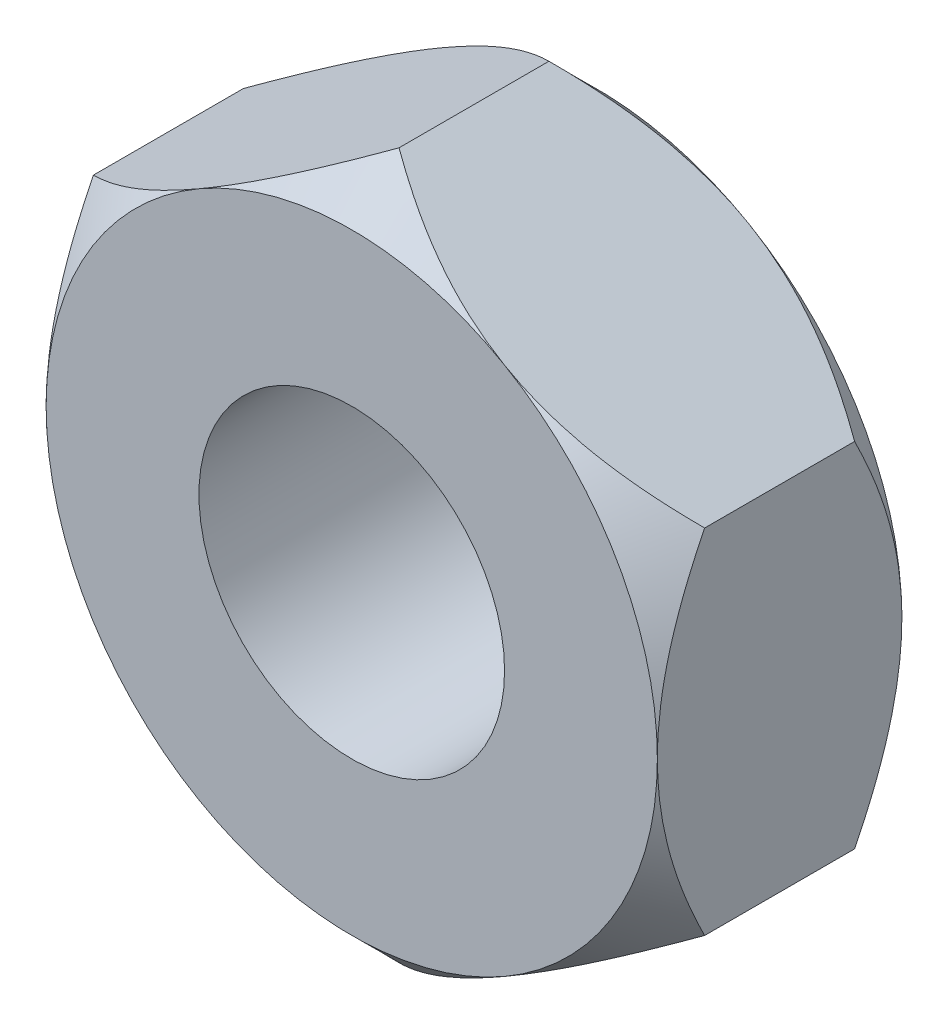
from build123d import *

# Parameters (mm, degrees)
ESBO_O1_R             = 1.25
EXTRUDE_H_DEPTH       = 2
ESBO_O2_OUTSIDE_W     = 12.58
ESBO_O2_OUTSIDE_H     = 13.354
ESBO_O2_OUTSIDE_R     = 2.5
CORTE_EXTRUS_O1_DEPTH = 2
CORTE_EXTRUS_O1_DRAFT = -45
ESBO_O3_OUTSIDE_W     = 12.58
ESBO_O3_OUTSIDE_H     = 13.354
ESBO_O3_OUTSIDE_R     = 2.5
CORTE_EXTRUS_O2_DEPTH = 2
CORTE_EXTRUS_O2_DRAFT = -45


with BuildPart() as part:
    # Esboço1 → H (new body)
    with BuildSketch(Plane.XY):
        Polygon((-2.5, 1.443375673), (-2.5, -1.443375673), (0, -2.886751346), (2.5, -1.443375673), (2.5, 1.443375673), (0, 2.886751346), align=None)
        Circle(ESBO_O1_R, mode=Mode.SUBTRACT)
    extrude(amount=EXTRUDE_H_DEPTH)


with BuildPart() as corte_extrus_o1_tool:
    # Esboço2 outside → Corte-extrusão1 (with draft: the straight prism first)
    with BuildSketch(Plane.XY.offset(2)):
        Rectangle(ESBO_O2_OUTSIDE_W, ESBO_O2_OUTSIDE_H)
        Circle(ESBO_O2_OUTSIDE_R, mode=Mode.SUBTRACT)
    extrude(amount=-CORTE_EXTRUS_O1_DEPTH)
    # Corte-extrusão1: the draft: its side faces are tilted about the plane it starts from
    corte_extrus_o1_sides = [corte_extrus_o1_tool.faces().sort_by_distance(p)[0] for p in [
        (0, -6.677, 1),
        (6.29, 0, 1),
        (0, 6.677, 1),
        (-6.29, 0, 1),
        (-2.5, 0, 1),
    ]]
    draft(corte_extrus_o1_sides, Plane.XY.offset(2), CORTE_EXTRUS_O1_DRAFT)


with BuildPart() as part_1:
    add(part.part)

    # Corte-extrusão1: cut by corte_extrus_o1_tool
    add(corte_extrus_o1_tool.part, mode=Mode.SUBTRACT)


with BuildPart() as corte_extrus_o2_tool:
    # Esboço3 outside → Corte-extrusão2 (with draft: the straight prism first)
    with BuildSketch(Plane(origin=(0, 0, 0), x_dir=(-1, 0, 0), z_dir=(0, 0, -1))):
        Rectangle(ESBO_O3_OUTSIDE_W, ESBO_O3_OUTSIDE_H)
        Circle(ESBO_O3_OUTSIDE_R, mode=Mode.SUBTRACT)
    extrude(amount=-CORTE_EXTRUS_O2_DEPTH)
    # Corte-extrusão2: the draft: its side faces are tilted about the plane it starts from
    corte_extrus_o2_sides = [corte_extrus_o2_tool.faces().sort_by_distance(p)[0] for p in [
        (0, -6.677, 1),
        (-6.29, 0, 1),
        (0, 6.677, 1),
        (6.29, 0, 1),
        (2.5, 0, 1),
    ]]
    draft(corte_extrus_o2_sides, Plane(origin=(0, 0, 0), x_dir=(-1, 0, 0), z_dir=(0, 0, -1)), CORTE_EXTRUS_O2_DRAFT)


with BuildPart() as part_2:
    add(part_1.part)

    # Corte-extrusão2: cut by corte_extrus_o2_tool
    add(corte_extrus_o2_tool.part, mode=Mode.SUBTRACT)


solid = part_2.part
